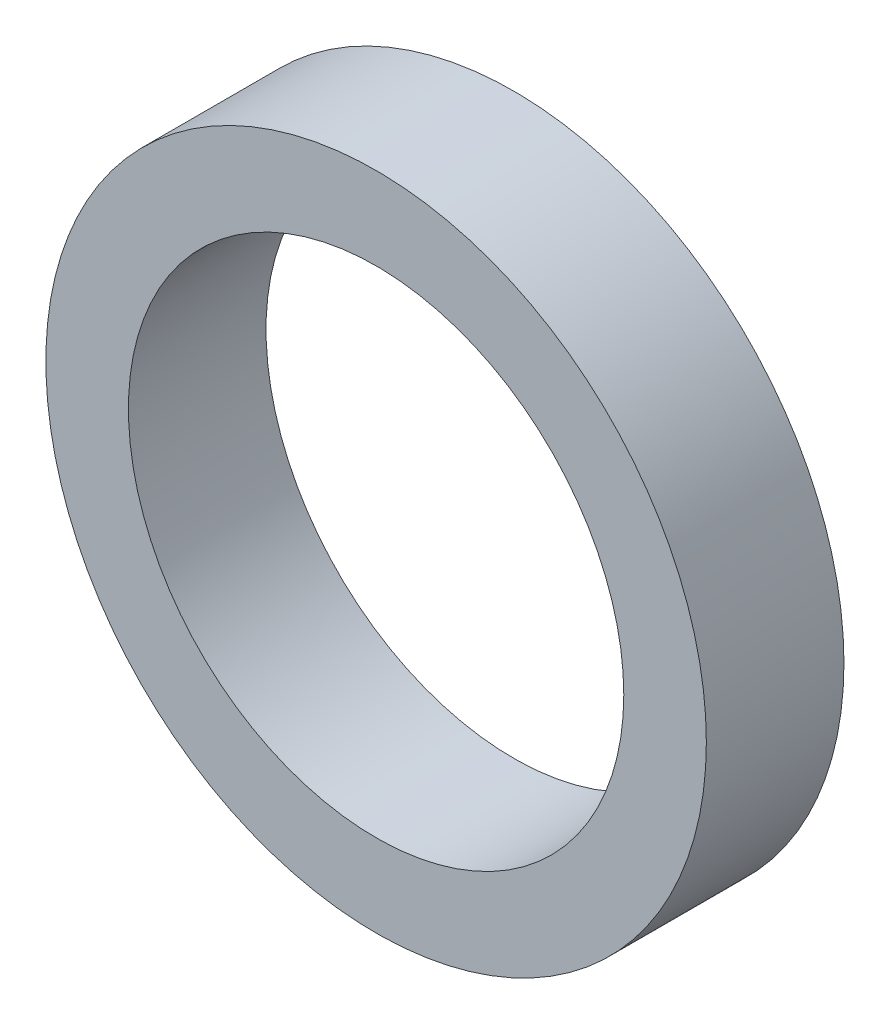
from build123d import *

# Parameters (mm, degrees)
SKETCH1_R           = 12
SKETCH1_R_2         = 9
BOSS_EXTRUDE1_DEPTH = 5


with BuildPart() as part:
    # Sketch1 → Boss-Extrude1 (new body)
    with BuildSketch(Plane.XY):
        Circle(SKETCH1_R)
        Circle(SKETCH1_R_2, mode=Mode.SUBTRACT)
    extrude(amount=BOSS_EXTRUDE1_DEPTH)


solid = part.part
